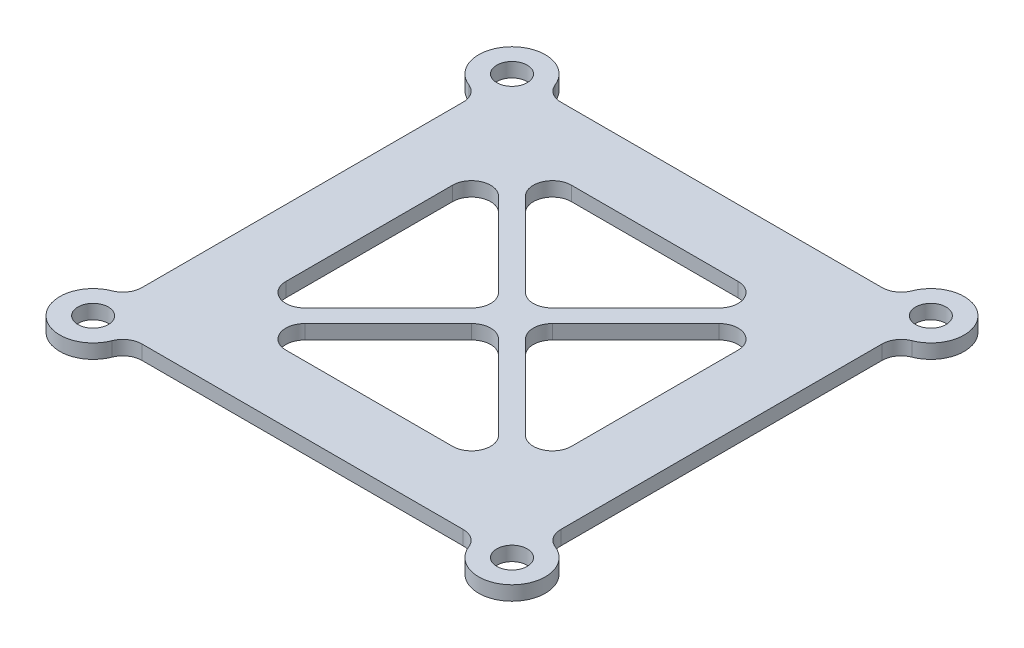
from build123d import *

# Parameters (mm, degrees)
BOSS_EXTRUDE1_DEPTH            = 0.75
FILLET1_R                      = 2
F_3_2_3_2_DIAMETER_HOLE1_D     = 3.2
F_3_2_3_2_DIAMETER_HOLE1_DEPTH = 10
F_3_2_3_2_DIAMETER_HOLE1_TIP   = 0.96137699
CUT_EXTRUDE1_DEPTH             = 1.5
FILLET2_R                      = 2


with BuildPart() as part:
    # Sketch1 → Boss-Extrude1 (new, symmetric)
    with BuildSketch(Plane(origin=(0, 0, 0), x_dir=(1, 0, 0), z_dir=(0, 1, 0))):
        with BuildLine():
            Line((-18.5, -22), (18.5, -22))
            ThreePointArc((18.5, -22), (24.474873734, -24.474873734), (22, -18.5))
            Line((22, -18.5), (22, 18.5))
            ThreePointArc((22, 18.5), (24.474873734, 24.474873734), (18.5, 22))
            Line((18.5, 22), (-18.5, 22))
            ThreePointArc((-18.5, 22), (-24.474873734, 24.474873734), (-22, 18.5))
            Line((-22, 18.5), (-22, -18.5))
            ThreePointArc((-22, -18.5), (-24.474873734, -24.474873734), (-18.5, -22))
        make_face()
    extrude(amount=BOSS_EXTRUDE1_DEPTH, both=True)

    # Fillet1
    fillet1_edges = [part.edges().sort_by_distance(p)[0] for p in [
        (-18.5, 0, -22),
        (18.5, 0, -22),
        (22, 0, -18.5),
        (22, 0, 18.5),
        (18.5, 0, 22),
        (-18.5, 0, 22),
        (-22, 0, 18.5),
        (-22, 0, -18.5),
    ]]
    fillet(fillet1_edges, radius=FILLET1_R)

    # Ø3.2 (3.2) Diameter Hole1
    with Locations(Plane(origin=(0, 0.75, 0), x_dir=(1, 0, 0), z_dir=(0, 1, 0))):
        with Locations((-22, 22), (-22, -22), (22, -22), (22, 22)):
            Hole(F_3_2_3_2_DIAMETER_HOLE1_D / 2, depth=F_3_2_3_2_DIAMETER_HOLE1_DEPTH)
            with Locations((0, 0, -(F_3_2_3_2_DIAMETER_HOLE1_DEPTH + F_3_2_3_2_DIAMETER_HOLE1_TIP / 2))):  # 118° drill point
                Cone(0, F_3_2_3_2_DIAMETER_HOLE1_D / 2, F_3_2_3_2_DIAMETER_HOLE1_TIP, mode=Mode.SUBTRACT)

    # Sketch4 → Cut-Extrude1 (cut)
    with BuildSketch(Plane(origin=(0, 0.75, 0), x_dir=(1, 0, 0), z_dir=(0, 1, 0))):
        Polygon((-1.414213562, 0), (-15, 13.585786438), (-15, -13.585786438), align=None)
        Polygon((13.585786438, 15), (-13.585786438, 15), (0, 1.414213562), align=None)
        Polygon((15, -13.585786438), (15, 13.585786438), (1.414213562, 0), align=None)
        Polygon((0, -1.414213562), (-13.585786438, -15), (13.585786438, -15), align=None)
    extrude(amount=-CUT_EXTRUDE1_DEPTH, mode=Mode.SUBTRACT)

    # Fillet2
    fillet2_edges = [part.edges().sort_by_distance(p)[0] for p in [
        (-1.414213562, 0, 0),
        (-15, 0, 13.585786438),
        (-15, 0, -13.585786438),
        (13.585786438, 0, -15),
        (0, 0, -1.414213562),
        (-13.585786438, 0, -15),
        (15, 0, -13.585786438),
        (15, 0, 13.585786438),
        (1.414213562, 0, 0),
        (0, 0, 1.414213562),
        (13.585786438, 0, 15),
        (-13.585786438, 0, 15),
    ]]
    fillet(fillet2_edges, radius=FILLET2_R)


solid = part.part
